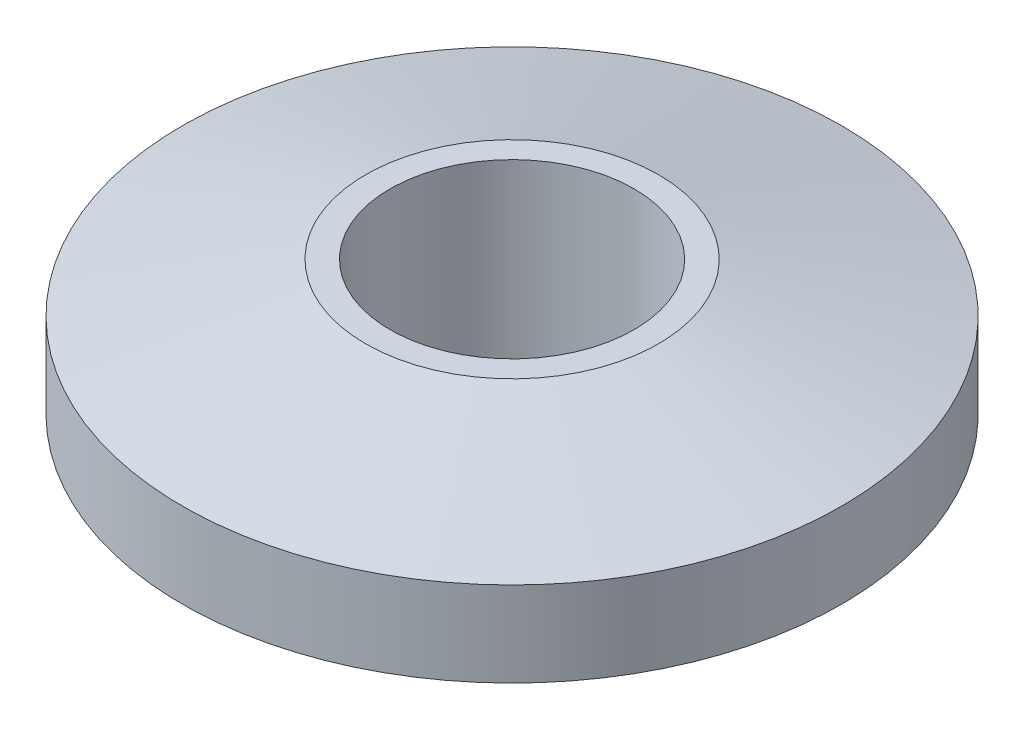
from build123d import *


with BuildPart() as part:
    # 草图1 → 旋转1 (revolve)
    with BuildSketch(Plane.XY, mode=Mode.PRIVATE) as revolve_1_sk:
        Polygon((-13.5, -1.740381057), (-13.5, 1.740381057), (-6, 3.75), (-5, 3.75), (-5, -3.75), (-6, -3.75), align=None)
    revolve(revolve_1_sk.sketch.rotate(Axis((0, 0, 0), (0, 1, 0)), 270), axis=Axis((0, 0, 0), (0, 1, 0)))


solid = part.part
